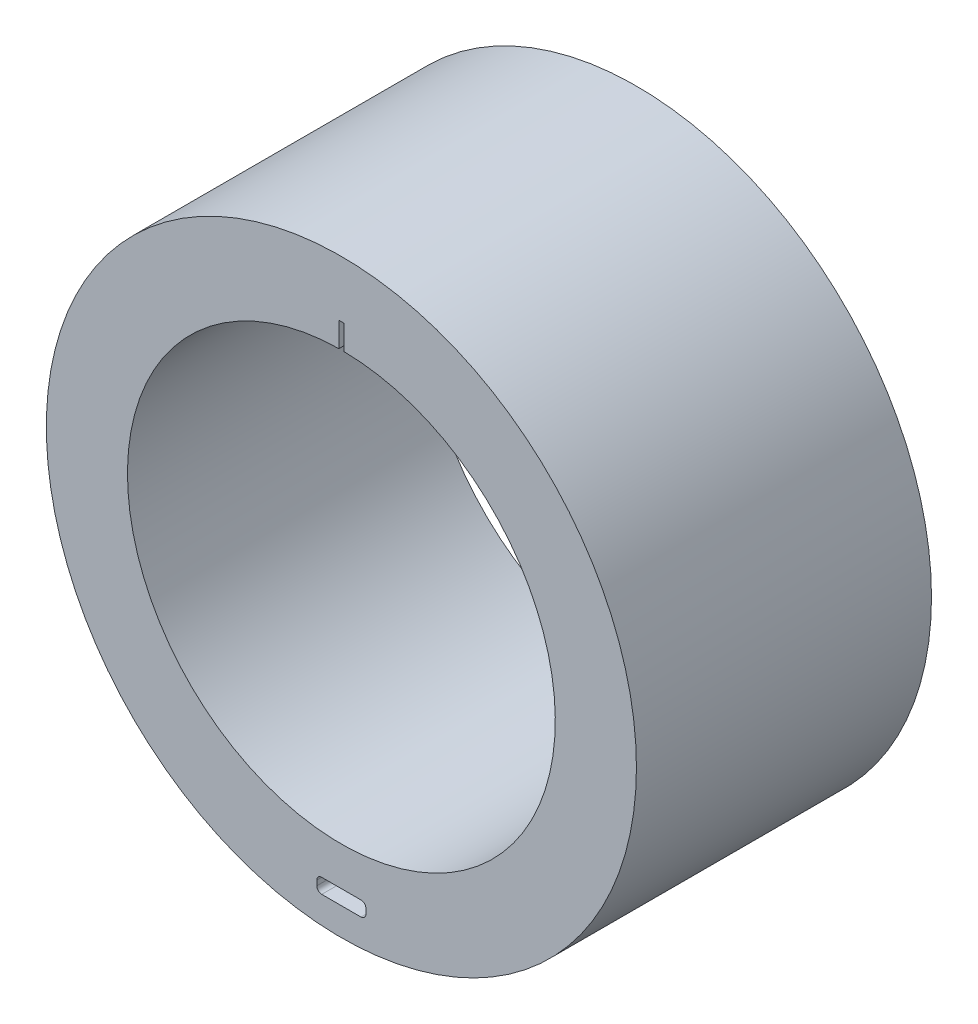
from build123d import *

# Parameters (mm, degrees)
SKETCH1_R          = 60
SKETCH1_R_2        = 43.5
EXTRUSION1_DEPTH   = 60
EXTRUSION3_START   = -60
EXTRUSION3_DEPTH   = 60
CUT_EXTRUDE2_DEPTH = 55
CUT_EXTRUDE3_DEPTH = 10
CUT_EXTRUDE4_DEPTH = 35
CUT_EXTRUDE5_DEPTH = 104.923048454
CUT_EXTRUDE6_DEPTH = 30
CUT_EXTRUDE7_DEPTH = 30


with BuildPart() as part:
    # Sketch1 → Extrusion1 (new body)
    with BuildSketch(Plane.XY):
        Circle(SKETCH1_R)
        Circle(SKETCH1_R_2, mode=Mode.SUBTRACT)
    extrude(amount=EXTRUSION1_DEPTH)

    # Sketch3 → Extrusion3 (cut)
    with BuildSketch(Plane.XY.offset(60).offset(EXTRUSION3_START)):
        with BuildLine():
            Line((-0.5, 48.5), (-0.5, 43.497126342))
            ThreePointArc((-0.5, 43.497126342), (0, 43.5), (0.5, 43.497126342))
            Line((0.5, 43.497126342), (0.5, 48.5))
            Line((0.5, 48.5), (-0.5, 48.5))
        make_face()
    extrude(amount=EXTRUSION3_DEPTH, mode=Mode.SUBTRACT)

    # Sketch4 → Cut-Extrude2 (cut)
    with BuildSketch(Plane(origin=(0, 0, 0), x_dir=(-1, 0, 0), z_dir=(0, 0, -1))):
        with BuildLine():
            ThreePointArc((-50.316139758, -0.506318633), (-49.782828126, -7.323954021), (-48.330045697, -14.006318633))
            Line((-48.330045697, -14.006318633), (-46.316139758, -14.006318633))
            ThreePointArc((-46.316139758, -14.006318633), (-45.609032977, -13.713425414), (-45.316139758, -13.006318633))
            Line((-45.316139758, -13.006318633), (-45.316139758, 11.993681367))
            ThreePointArc((-45.316139758, 11.993681367), (-45.609032977, 12.700788148), (-46.316139758, 12.993681367))
            Line((-46.316139758, 12.993681367), (-54.316139758, 12.993681367))
            ThreePointArc((-54.316139758, 12.993681367), (-55.023246539, 12.700788148), (-55.316139758, 11.993681367))
            Line((-55.316139758, 11.993681367), (-55.316139758, -0.506318633))
            Line((-55.316139758, -0.506318633), (-50.316139758, -0.506318633))
        make_face()
        with BuildLine():
            Line((-54.316139758, -14.006318633), (-48.330045697, -14.006318633))
            ThreePointArc((-48.330045697, -14.006318633), (-49.782828126, -7.323954021), (-50.316139758, -0.506318633))
            Line((-50.316139758, -0.506318633), (-55.316139758, -0.506318633))
            Line((-55.316139758, -0.506318633), (-55.316139758, -13.006318633))
            ThreePointArc((-55.316139758, -13.006318633), (-55.023246539, -13.713425414), (-54.316139758, -14.006318633))
        make_face()
        with BuildLine():
            Line((55.316139758, 0), (50.318687172, 0))
            ThreePointArc((50.318687172, 0), (49.819046203, -7.07339481), (48.330045697, -14.006318633))
            Line((48.330045697, -14.006318633), (54.316139758, -14.006318633))
            ThreePointArc((54.316139758, -14.006318633), (55.023246539, -13.713425414), (55.316139758, -13.006318633))
            Line((55.316139758, -13.006318633), (55.316139758, 0))
        make_face()
        with BuildLine():
            ThreePointArc((48.330045697, -14.006318633), (49.819046203, -7.07339481), (50.318687172, 0))
            Line((50.318687172, 0), (55.316139758, 0))
            Line((55.316139758, 0), (55.316139758, 11.993681367))
            ThreePointArc((55.316139758, 11.993681367), (55.023246539, 12.700788148), (54.316139758, 12.993681367))
            Line((54.316139758, 12.993681367), (46.316139758, 12.993681367))
            ThreePointArc((46.316139758, 12.993681367), (45.609032977, 12.700788148), (45.316139758, 11.993681367))
            Line((45.316139758, 11.993681367), (45.316139758, -13.006318633))
            ThreePointArc((45.316139758, -13.006318633), (45.609032977, -13.713425414), (46.316139758, -14.006318633))
            Line((46.316139758, -14.006318633), (48.330045697, -14.006318633))
        make_face()
    extrude(amount=-CUT_EXTRUDE2_DEPTH, mode=Mode.SUBTRACT)

    # Sketch5 → Cut-Extrude3 (cut)
    with BuildSketch(Plane(origin=(0, 0, 0), x_dir=(-1, 0, 0), z_dir=(0, 0, -1))):
        with BuildLine():
            Line((-52.51879057, -14.006318633), (-48.51879057, -14.006318633))
            ThreePointArc((-48.51879057, -14.006318633), (0, -50.5), (48.51879057, -14.006318633))
            Line((48.51879057, -14.006318633), (51.634029848, -14.006318633))
            ThreePointArc((51.634029848, -14.006318633), (-0.442380361, -55.246730559), (-52.51879057, -14.006318633))
        make_face()
    extrude(amount=-CUT_EXTRUDE3_DEPTH, mode=Mode.SUBTRACT)

    # Sketch7 → Cut-Extrude4 (cut)
    with BuildSketch(Plane(origin=(0, 0, 0), x_dir=(-1, 0, 0), z_dir=(0, 0, -1))):
        with BuildLine():
            Line((21.085956356, -51.080456264), (42.59953536, -36.48025358))
            ThreePointArc((42.59953536, -36.48025358), (43.020154485, -35.840827283), (42.865434449, -35.091261977))
            Line((42.865434449, -35.091261977), (39.496156907, -30.126589899))
            ThreePointArc((39.496156907, -30.126589899), (38.856730609, -29.705970774), (38.107165303, -29.860690809))
            Line((38.107165303, -29.860690809), (16.593586299, -44.460893494))
            ThreePointArc((16.593586299, -44.460893494), (16.172967174, -45.100319791), (16.32768721, -45.849885097))
            Line((16.32768721, -45.849885097), (19.696964752, -50.814557175))
            ThreePointArc((19.696964752, -50.814557175), (20.33639105, -51.2351763), (21.085956356, -51.080456264))
        make_face()
    extrude(amount=-CUT_EXTRUDE4_DEPTH, mode=Mode.SUBTRACT)

    # Sketch8 → Cut-Extrude5 (cut, through all)
    with BuildSketch(Plane(origin=(0, 0, 0), x_dir=(-1, 0, 0), z_dir=(0, 0, -1))):
        with BuildLine():
            Line((0, -54.348403173), (0, -51.348403173))
            Line((0, -51.348403173), (-4, -51.348403173))
            ThreePointArc((-4, -51.348403173), (-4.707106781, -51.641296392), (-5, -52.348403173))
            Line((-5, -52.348403173), (-5, -53.348403173))
            ThreePointArc((-5, -53.348403173), (-4.707106781, -54.055509954), (-4, -54.348403173))
            Line((-4, -54.348403173), (0, -54.348403173))
        make_face()
        with BuildLine():
            Line((4, -51.348403173), (0, -51.348403173))
            Line((0, -51.348403173), (0, -54.348403173))
            Line((0, -54.348403173), (4, -54.348403173))
            ThreePointArc((4, -54.348403173), (4.707106781, -54.055509954), (5, -53.348403173))
            Line((5, -53.348403173), (5, -52.348403173))
            ThreePointArc((5, -52.348403173), (4.707106781, -51.641296392), (4, -51.348403173))
        make_face()
    extrude(amount=-CUT_EXTRUDE5_DEPTH, mode=Mode.SUBTRACT)

    # Sketch9 → Cut-Extrude6 (cut)
    with BuildSketch(Plane(origin=(0, 0, 0), x_dir=(-1, 0, 0), z_dir=(0, 0, -1))):
        with BuildLine():
            Line((-46.541704455, -20.656628598), (-48.174808597, -21.811172171))
            ThreePointArc((-48.174808597, -21.811172171), (-50.216361173, -25.047948966), (-49.371210022, -28.780291457))
            Line((-49.371210022, -28.780291457), (-43.598492159, -36.945812168))
            ThreePointArc((-43.598492159, -36.945812168), (-40.361715364, -38.987364744), (-36.629372873, -38.142213593))
            Line((-36.629372873, -38.142213593), (-34.996268731, -36.98767002))
            ThreePointArc((-34.996268731, -36.98767002), (-32.954716155, -33.750893225), (-33.799867306, -30.018550734))
            Line((-33.799867306, -30.018550734), (-39.572585168, -21.853030023))
            ThreePointArc((-39.572585168, -21.853030023), (-42.809361964, -19.811477447), (-46.541704455, -20.656628598))
        make_face()
    extrude(amount=-CUT_EXTRUDE6_DEPTH, mode=Mode.SUBTRACT)

    # Sketch10 → Cut-Extrude7 (cut)
    with BuildSketch(Plane(origin=(0, 0, 0), x_dir=(-1, 0, 0), z_dir=(0, 0, -1))):
        with BuildLine():
            Line((-16.862196749, -52.664700174), (-15.619636194, -50.065338059))
            Line((-15.619636194, -50.065338059), (-29.152890755, -43.596101551))
            Line((-29.152890755, -43.596101551), (-30.352191828, -46.104967426))
            ThreePointArc((-30.352191828, -46.104967426), (-23.838237424, -49.859970652), (-16.862196749, -52.664700174))
        make_face()
        with BuildLine():
            Line((-16.913483495, -52.771988971), (-16.862196749, -52.664700174))
            ThreePointArc((-16.862196749, -52.664700174), (-23.838237424, -49.859970652), (-30.352191828, -46.104967426))
            Line((-30.352191828, -46.104967426), (-30.446738056, -46.302752463))
            ThreePointArc((-30.446738056, -46.302752463), (-30.487447557, -47.067035901), (-29.975803519, -47.636251867))
            Line((-29.975803519, -47.636251867), (-18.2469829, -53.242923508))
            ThreePointArc((-18.2469829, -53.242923508), (-17.482699462, -53.283633009), (-16.913483495, -52.771988971))
        make_face()
        with BuildLine():
            ThreePointArc((-28.304856483, -41.822064744), (-21.77976291, -45.561957021), (-14.771601922, -48.291301252))
            Line((-14.771601922, -48.291301252), (-14.325788892, -47.358687147))
            ThreePointArc((-14.325788892, -47.358687147), (-14.285079391, -46.594403708), (-14.796723429, -46.025187742))
            Line((-14.796723429, -46.025187742), (-26.525544048, -40.418516102))
            ThreePointArc((-26.525544048, -40.418516102), (-27.289827487, -40.377806601), (-27.859043453, -40.889450639))
            Line((-27.859043453, -40.889450639), (-28.304856483, -41.822064744))
        make_face()
        with BuildLine():
            Line((-29.152890755, -43.596101551), (-15.619636194, -50.065338059))
            Line((-15.619636194, -50.065338059), (-14.771601922, -48.291301252))
            ThreePointArc((-14.771601922, -48.291301252), (-21.77976291, -45.561957021), (-28.304856483, -41.822064744))
            Line((-28.304856483, -41.822064744), (-29.152890755, -43.596101551))
        make_face()
    extrude(amount=-CUT_EXTRUDE7_DEPTH, mode=Mode.SUBTRACT)


solid = part.part
